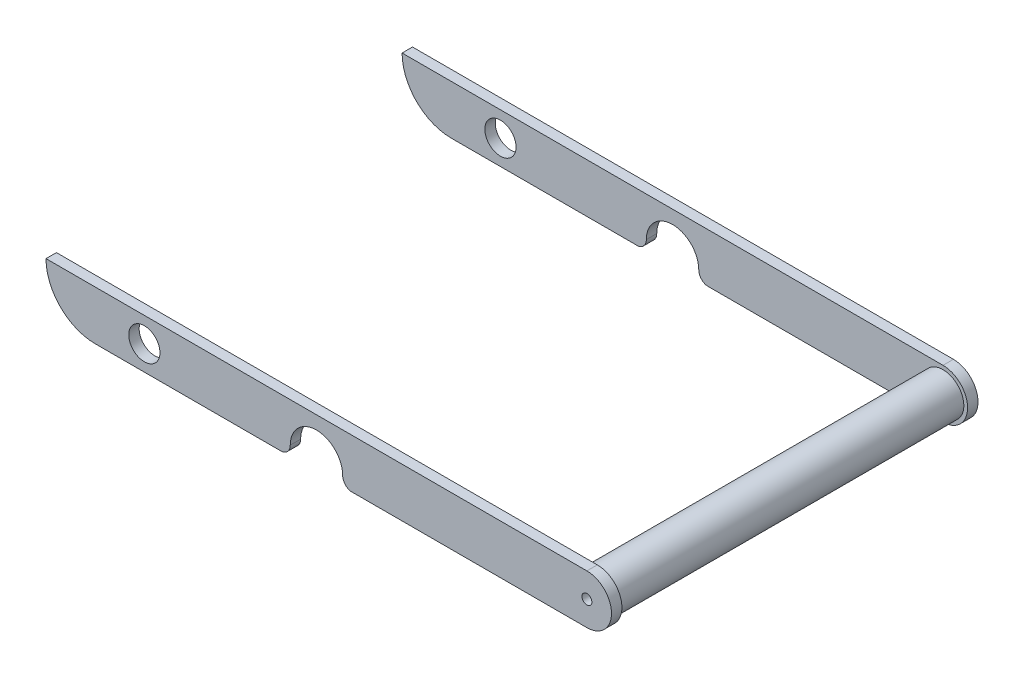
from build123d import *

# Parameters (mm, degrees)
SKETCH1_R           = 4.7625
BOSS_EXTRUDE1_DEPTH = 3.175
SKETCH2_R           = 6.35
BOSS_EXTRUDE2_DEPTH = 105.4492
SKETCH3_R           = 4.7625
BOSS_EXTRUDE3_DEPTH = 3.175
SKETCH5_R           = 1.518393352
CUT_EXTRUDE1_DEPTH  = 194.727414479


with BuildPart() as part:
    # Sketch1 → Boss-Extrude1 (new body)
    with BuildSketch(Plane.XY):
        with BuildLine():
            Line((0, 0), (150, 0))
            ThreePointArc((150, 0), (157.5, 7.5), (150, 15))
            Line((150, 15), (-15, 15))
            ThreePointArc((-15, 15), (-10.606601718, 4.393398282), (0, 0))
        make_face()
        with Locations((15, 7.5)):
            Circle(SKETCH1_R, mode=Mode.SUBTRACT)
    extrude(amount=BOSS_EXTRUDE1_DEPTH)

    # Sketch2 → Boss-Extrude2 (add)
    with BuildSketch(Plane.XY.offset(3.175)):
        with Locations(Location((150, 7.5, 0), (0, 0, 180))):
            Circle(SKETCH2_R)
    extrude(amount=BOSS_EXTRUDE2_DEPTH)

    # Sketch3 → Boss-Extrude3 (add)
    with BuildSketch(Plane.XY.offset(108.6242)):
        with BuildLine():
            Line((0, 0), (150, 0))
            ThreePointArc((150, 0), (157.5, 7.5), (150, 15))
            Line((150, 15), (-15, 15))
            ThreePointArc((-15, 15), (-10.606601718, 4.393398282), (0, 0))
        make_face()
        with Locations((15, 7.5)):
            Circle(SKETCH3_R, mode=Mode.SUBTRACT)
    extrude(amount=BOSS_EXTRUDE3_DEPTH)

    # Sketch5 → Cut-Extrude1 (cut, through all)
    with BuildSketch(Plane.XY.offset(111.7992)):
        with Locations((150, 7.5)):
            Circle(SKETCH5_R)
        with BuildLine():
            Line((57.017518256, 0), (77.982481744, 0))
            ThreePointArc((77.982481744, 0), (76.202985115, 1.025330402), (75.5, 2.955025356))
            ThreePointArc((75.5, 2.955025356), (67.5, 10.955025356), (59.5, 2.955025356))
            ThreePointArc((59.5, 2.955025356), (58.797014885, 1.025330402), (57.017518256, 0))
        make_face()
    extrude(amount=-CUT_EXTRUDE1_DEPTH, mode=Mode.SUBTRACT)


solid = part.part
